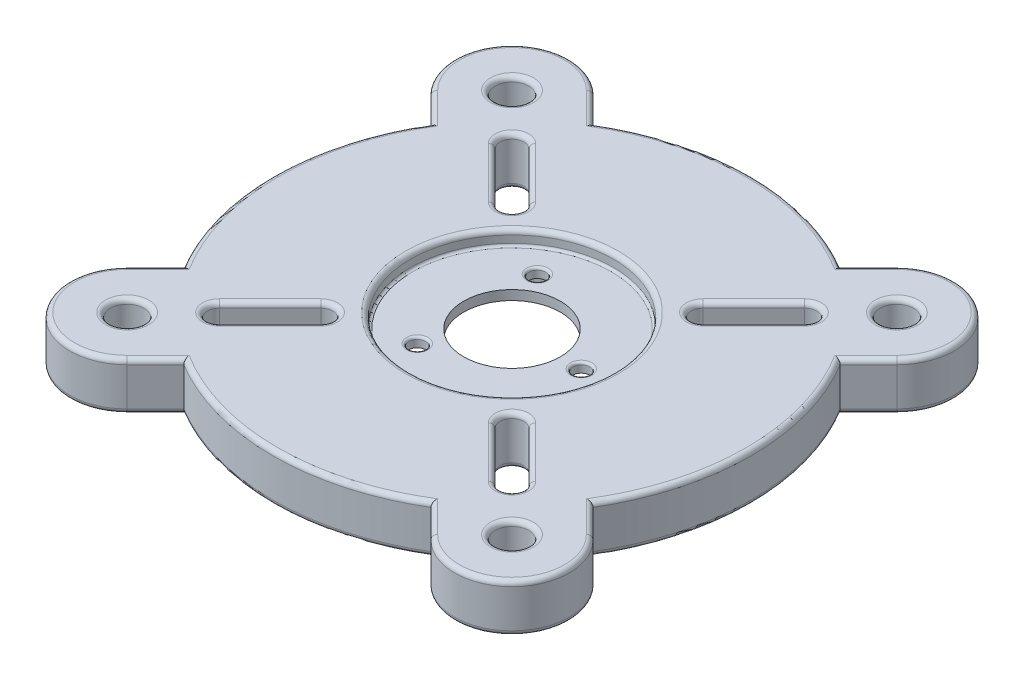
from build123d import *

# Parameters (mm, degrees)
SKETCH1_R               = 3.5
BOSS_EXTRUDE1_DEPTH     = 10
CUT_EXTRUDE1_DEPTH      = 75.564492801
CUT_EXTRUDE1_DEPTH_BACK = 75.564492801
SKETCH2_R               = 1.75
SKETCH2_3_R             = 21.25
SKETCH2_3_R_2           = 1.75
CUT_EXTRUDE2_DEPTH      = 3
FILLET1_R               = 1
FILLET2_R               = 1
FILLET3_R               = 0.5
CUT_EXTRUDE3_START      = -5
SKETCH4_R               = 21.25
SKETCH4_R_2             = 1.75
CUT_EXTRUDE3_DEPTH      = 5
SKETCH5_R               = 10.1
CUT_EXTRUDE4_DEPTH      = 5


with BuildPart() as part:
    # Sketch1 → Boss-Extrude1 (new body)
    with BuildSketch(Plane(origin=(0, 0, 0), x_dir=(1, 0, 0), z_dir=(0, 1, 0))):
        with BuildLine():
            Line((-42.807285978, -25.836723229), (-48.734030578, -31.763467829))
            ThreePointArc((-48.734030578, -31.763467829), (-48.734030578, -48.734030578), (-31.763467829, -48.734030578))
            Line((-31.763467829, -48.734030578), (-25.836723229, -42.807285978))
            ThreePointArc((-25.836723229, -42.807285978), (0, -50), (25.836723229, -42.807285978))
            Line((25.836723229, -42.807285978), (31.718887967, -48.689450716))
            ThreePointArc((31.718887967, -48.689450716), (48.689450716, -48.689450716), (48.689450716, -31.718887967))
            Line((48.689450716, -31.718887967), (42.807285978, -25.836723229))
            ThreePointArc((42.807285978, -25.836723229), (50, 0), (42.807285978, 25.836723229))
            Line((42.807285978, 25.836723229), (48.734030578, 31.763467829))
            ThreePointArc((48.734030578, 31.763467829), (48.734030578, 48.734030578), (31.763467829, 48.734030578))
            Line((31.763467829, 48.734030578), (25.836723229, 42.807285978))
            ThreePointArc((25.836723229, 42.807285978), (0, 50), (-25.836723229, 42.807285978))
            Line((-25.836723229, 42.807285978), (-31.718887967, 48.689450716))
            ThreePointArc((-31.718887967, 48.689450716), (-48.689450716, 48.689450716), (-48.689450716, 31.718887967))
            Line((-48.689450716, 31.718887967), (-42.807285978, 25.836723229))
            ThreePointArc((-42.807285978, 25.836723229), (-50, 0), (-42.807285978, -25.836723229))
        make_face()
        with Locations((-40.248749204, -40.248749204)):
            Circle(SKETCH1_R, mode=Mode.SUBTRACT)
        with BuildLine():
            Line((-18.232233047, -21.767766953), (-28.838834765, -32.374368671))
            ThreePointArc((-28.838834765, -32.374368671), (-32.374368671, -32.374368671), (-32.374368671, -28.838834765))
            Line((-32.374368671, -28.838834765), (-21.767766953, -18.232233047))
            ThreePointArc((-21.767766953, -18.232233047), (-18.232233047, -18.232233047), (-18.232233047, -21.767766953))
        make_face(mode=Mode.SUBTRACT)
        with BuildLine():
            Line((-21.767766953, 18.232233047), (-32.374368671, 28.838834765))
            ThreePointArc((-32.374368671, 28.838834765), (-32.374368671, 32.374368671), (-28.838834765, 32.374368671))
            Line((-28.838834765, 32.374368671), (-18.232233047, 21.767766953))
            ThreePointArc((-18.232233047, 21.767766953), (-18.232233047, 18.232233047), (-21.767766953, 18.232233047))
        make_face(mode=Mode.SUBTRACT)
        with BuildLine():
            Line((18.232233047, 21.767766953), (28.838834765, 32.374368671))
            ThreePointArc((28.838834765, 32.374368671), (32.374368671, 32.374368671), (32.374368671, 28.838834765))
            Line((32.374368671, 28.838834765), (21.767766953, 18.232233047))
            ThreePointArc((21.767766953, 18.232233047), (18.232233047, 18.232233047), (18.232233047, 21.767766953))
        make_face(mode=Mode.SUBTRACT)
        with BuildLine():
            Line((21.767766953, -18.232233047), (32.374368671, -28.838834765))
            ThreePointArc((32.374368671, -28.838834765), (32.374368671, -32.374368671), (28.838834765, -32.374368671))
            Line((28.838834765, -32.374368671), (18.232233047, -21.767766953))
            ThreePointArc((18.232233047, -21.767766953), (18.232233047, -18.232233047), (21.767766953, -18.232233047))
        make_face(mode=Mode.SUBTRACT)
        with Locations((-40.248749204, 40.248749204)):
            Circle(SKETCH1_R, mode=Mode.SUBTRACT)
        with Locations((40.248749204, 40.248749204)):
            Circle(SKETCH1_R, mode=Mode.SUBTRACT)
        with Locations((40.248749204, -40.248749204)):
            Circle(SKETCH1_R, mode=Mode.SUBTRACT)
    extrude(amount=BOSS_EXTRUDE1_DEPTH)

    # Sketch2 → Cut-Extrude1 (cut, two sides: drawn at the far end of the back side and taken through both)
    with BuildSketch(Plane(origin=(0, 10, 0), x_dir=(1, 0, 0), z_dir=(0, 1, 0)).offset(-CUT_EXTRUDE1_DEPTH_BACK)):
        with Locations((14.5, 0)):
            Circle(SKETCH2_R)
        with Locations((-7.25, -12.557368355)):
            Circle(SKETCH2_R)
        with Locations((-7.25, 12.557368355)):
            Circle(SKETCH2_R)
    extrude(amount=CUT_EXTRUDE1_DEPTH + CUT_EXTRUDE1_DEPTH_BACK, mode=Mode.SUBTRACT)

    # Sketch2<3> → Cut-Extrude2 (cut)
    with BuildSketch(Plane(origin=(0, 10, 0), x_dir=(1, 0, 0), z_dir=(0, 1, 0))):
        Circle(SKETCH2_3_R)
        with Locations((14.5, 0)):
            Circle(SKETCH2_3_R_2, mode=Mode.SUBTRACT)
        with Locations((-7.25, -12.557368355)):
            Circle(SKETCH2_3_R_2, mode=Mode.SUBTRACT)
        with Locations((-7.25, 12.557368355)):
            Circle(SKETCH2_3_R_2, mode=Mode.SUBTRACT)
    extrude(amount=-CUT_EXTRUDE2_DEPTH, mode=Mode.SUBTRACT)

    # Fillet1
    fillet1_edges = [part.edges().sort_by_distance(p)[0] for p in [
        (28.800095529, 10, -45.770658278),
        (48.734030578, 10, -48.734030578),
        (45.770658278, 10, -28.800095529),
        (50, 10, 0),
        (45.748368347, 10, 28.777805598),
        (48.689450716, 10, 48.689450716),
        (28.777805598, 10, 45.748368347),
        (0, 10, 50),
        (-28.800095529, 10, 45.770658278),
        (-48.734030578, 10, 48.734030578),
        (-45.770658278, 10, 28.800095529),
        (-50, 10, 0),
        (-45.748368347, 10, -28.777805598),
        (-48.689450716, 10, -48.689450716),
        (-28.777805598, 10, -45.748368347),
        (0, 10, -50),
        (-43.748749204, 10, -40.248749204),
        (-23.535533906, 10, 27.071067812),
        (-18.232233047, 10, 18.232233047),
        (-27.071067812, 10, 23.535533906),
        (-32.374368671, 10, 32.374368671),
        (-43.748749204, 10, 40.248749204),
        (-27.071067812, 10, -23.535533906),
        (-18.232233047, 10, -18.232233047),
        (-23.535533906, 10, -27.071067812),
        (-32.374368671, 10, -32.374368671),
        (27.071067812, 10, 23.535533906),
        (18.232233047, 10, 18.232233047),
        (23.535533906, 10, 27.071067812),
        (32.374368671, 10, 32.374368671),
        (36.748749204, 10, 40.248749204),
        (36.748749204, 10, -40.248749204),
        (23.535533906, 10, -27.071067812),
        (18.232233047, 10, -18.232233047),
        (27.071067812, 10, -23.535533906),
        (32.374368671, 10, -32.374368671),
        (-21.25, 10, 0),
    ]]
    fillet(fillet1_edges, radius=FILLET1_R)

    # Fillet2
    fillet2_edges = [part.edges().sort_by_distance(p)[0] for p in [
        (-43.748749204, 0, -40.248749204),
        (-27.071067812, 0, 23.535533906),
        (-18.232233047, 0, 18.232233047),
        (-23.535533906, 0, 27.071067812),
        (-32.374368671, 0, 32.374368671),
        (-43.748749204, 0, 40.248749204),
        (-23.535533906, 0, -27.071067812),
        (-18.232233047, 0, -18.232233047),
        (-27.071067812, 0, -23.535533906),
        (-32.374368671, 0, -32.374368671),
        (23.535533906, 0, 27.071067812),
        (18.232233047, 0, 18.232233047),
        (27.071067812, 0, 23.535533906),
        (32.374368671, 0, 32.374368671),
        (36.748749204, 0, 40.248749204),
        (36.748749204, 0, -40.248749204),
        (27.071067812, 0, -23.535533906),
        (18.232233047, 0, -18.232233047),
        (23.535533906, 0, -27.071067812),
        (32.374368671, 0, -32.374368671),
        (45.770658278, 0, -28.800095529),
        (48.734030578, 0, -48.734030578),
        (28.800095529, 0, -45.770658278),
        (0, 0, -50),
        (-28.777805598, 0, -45.748368347),
        (-48.689450716, 0, -48.689450716),
        (-45.748368347, 0, -28.777805598),
        (-50, 0, 0),
        (-45.770658278, 0, 28.800095529),
        (-48.734030578, 0, 48.734030578),
        (-28.800095529, 0, 45.770658278),
        (0, 0, 50),
        (28.777805598, 0, 45.748368347),
        (48.689450716, 0, 48.689450716),
        (45.748368347, 0, 28.777805598),
        (50, 0, 0),
        (-9, 0, 12.557368355),
        (-9, 0, -12.557368355),
        (12.75, 0, 0),
    ]]
    fillet(fillet2_edges, radius=FILLET2_R)

    # Fillet3
    fillet3_edges = [part.edges().sort_by_distance(p)[0] for p in [
        (-21.25, 7, 0),
        (12.75, 7, 0),
        (-9, 7, 12.557368355),
        (-9, 7, -12.557368355),
    ]]
    fillet(fillet3_edges, radius=FILLET3_R)

    # Sketch4 → Cut-Extrude3 (cut)
    with BuildSketch(Plane.XZ.offset(CUT_EXTRUDE3_START)):
        Circle(SKETCH4_R)
        with Locations((-7.25, -12.557368355)):
            Circle(SKETCH4_R_2, mode=Mode.SUBTRACT)
        with Locations((14.5, 0)):
            Circle(SKETCH4_R_2, mode=Mode.SUBTRACT)
        with Locations((-7.25, 12.557368355)):
            Circle(SKETCH4_R_2, mode=Mode.SUBTRACT)
    extrude(amount=CUT_EXTRUDE3_DEPTH, mode=Mode.SUBTRACT)

    # Sketch5 → Cut-Extrude4 (cut)
    with BuildSketch(Plane.XZ.offset(-5)):
        Circle(SKETCH5_R)
    extrude(amount=-CUT_EXTRUDE4_DEPTH, mode=Mode.SUBTRACT)


solid = part.part
